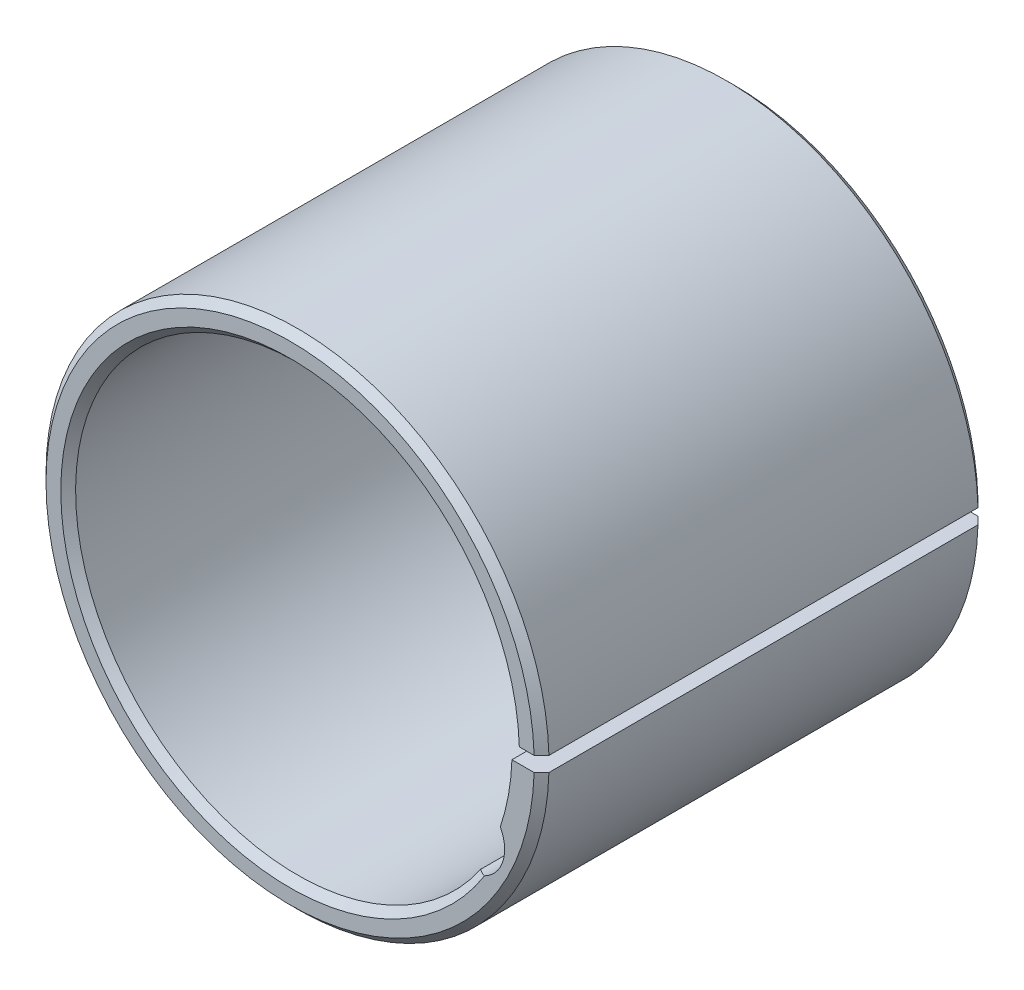
from build123d import *

# Parameters (mm, degrees)
BASE_EXTRUSION_DEPTH = 30
CHANFREIN1_SIZE      = 0.5


with BuildPart() as part:
    # Esquisse1 → Base-Extrusion (new body)
    with BuildSketch(Plane.XY):
        with BuildLine():
            Line((14.991664351, 0.5), (16.992645468, 0.5))
            ThreePointArc((16.992645468, 0.5), (-17, 0), (16.992645468, -0.5))
            Line((16.992645468, -0.5), (14.991664351, -0.5))
            ThreePointArc((14.991664351, -0.5), (14.756961273, -2.689255286), (14.204299838, -4.820566991))
            ThreePointArc((14.204299838, -4.820566991), (14.236067977, -7.118033989), (12.379033495, -8.471099676))
            ThreePointArc((12.379033495, -8.471099676), (-14.401698945, 4.194170658), (14.991664351, 0.5))
        make_face()
    extrude(amount=BASE_EXTRUSION_DEPTH)

    # Chanfrein1
    chanfrein1_edges = [part.edges().sort_by_distance(p)[0] for p in [
        (-14.401698945, 4.194170658, 30),
        (-17, 0, 30),
        (-17, 0, 0),
        (-14.401698945, 4.194170658, 0),
    ]]
    chamfer(chanfrein1_edges, length=CHANFREIN1_SIZE)


solid = part.part
